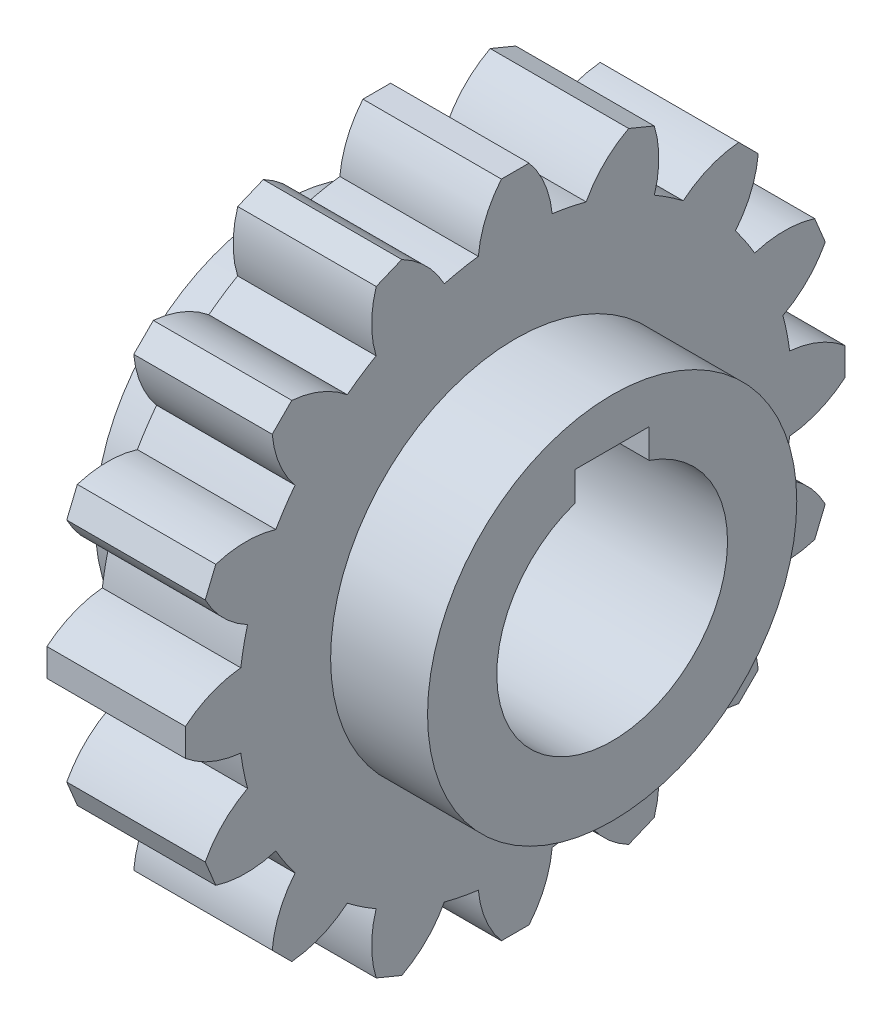
from build123d import *

# Parameters (mm, degrees)
SKETCH1_R           = 30
BOSS_EXTRUDE1_DEPTH = 7.5
BOSS_EXTRUDE2_DEPTH = 15
CIRPATTERN1_COUNT   = 16
SKETCH3_R           = 20
BOSS_EXTRUDE3_DEPTH = 18
CUT_EXTRUDE1_DEPTH  = 63.04491357


with BuildPart() as part:
    # Sketch1 → Boss-Extrude1 (new, symmetric)
    with BuildSketch(Plane(origin=(0, 0, 0), x_dir=(0, 0, -1), z_dir=(1, 0, 0))):
        Circle(SKETCH1_R)
    extrude(amount=BOSS_EXTRUDE1_DEPTH, both=True)

    # Sketch2 → Boss-Extrude2 (add)
    with BuildSketch(Plane(origin=(7.5, 0, 0), x_dir=(0, 0, -1), z_dir=(1, 0, 0))):
        with BuildLine():
            Line((-1.5, 35.732137495), (1.5, 35.732137495))
            ThreePointArc((1.5, 35.732137495), (3.203300204, 32.92101258), (4, 29.732137495))
            ThreePointArc((4, 29.732137495), (0, -30), (-4, 29.732137495))
            ThreePointArc((-4, 29.732137495), (-3.203300204, 32.92101258), (-1.5, 35.732137495))
        make_face()
    boss_extrude2 = extrude(amount=-BOSS_EXTRUDE2_DEPTH)

    # CirPattern1: Boss-Extrude2 ×16 about axis
    cirpattern1_axis = Axis((0, 0, 0), (1, 0, 0))
    for i in range(1, CIRPATTERN1_COUNT):
        add(boss_extrude2.rotate(cirpattern1_axis, i * 360 / CIRPATTERN1_COUNT))

    # Sketch3 → Boss-Extrude3 (add, symmetric)
    with BuildSketch(Plane(origin=(0, 0, 0), x_dir=(0, 0, -1), z_dir=(1, 0, 0))):
        Circle(SKETCH3_R)
    extrude(amount=BOSS_EXTRUDE3_DEPTH, both=True)

    # Sketch4 → Cut-Extrude1 (cut, through all)
    with BuildSketch(Plane(origin=(18, 0, 0), x_dir=(0, 0, -1), z_dir=(1, 0, 0))):
        with BuildLine():
            Line((-4, 15), (4, 15))
            Line((4, 15), (4, 11.842719282))
            ThreePointArc((4, 11.842719282), (0, -12.5), (-4, 11.842719282))
            Line((-4, 11.842719282), (-4, 15))
        make_face()
    extrude(amount=-CUT_EXTRUDE1_DEPTH, mode=Mode.SUBTRACT)


solid = part.part
